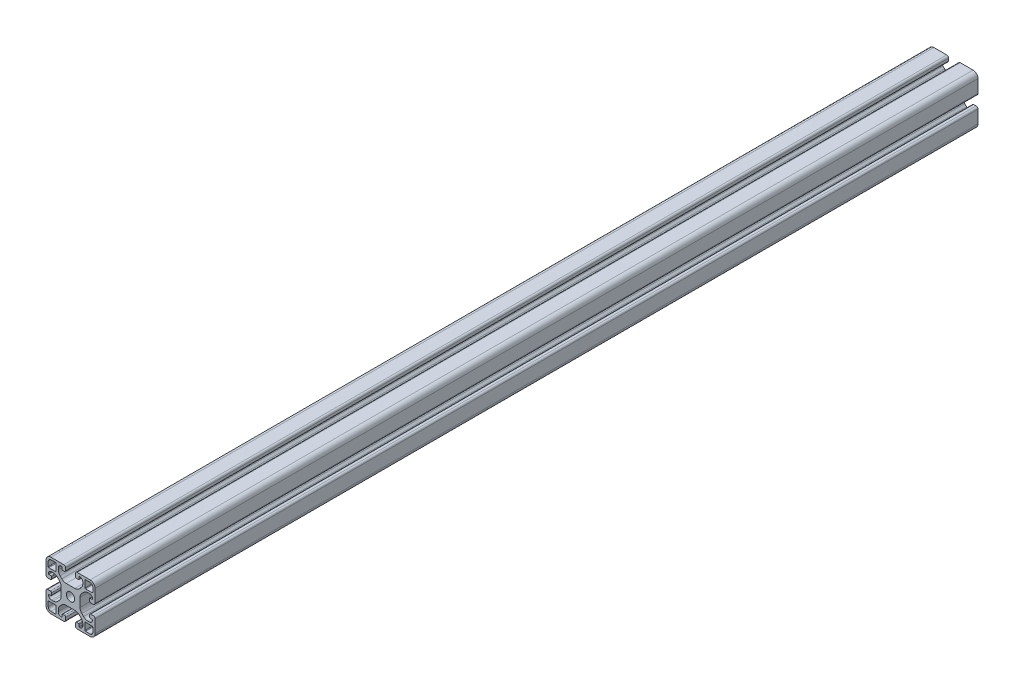
from build123d import *

# Parameters (mm, degrees)
ESQUISSE1_R        = 3.4
BOSS_EXTRU_1_DEPTH = 720


with BuildPart() as part:
    # Esquisse1 → Boss.-Extru.1 (new body)
    with BuildSketch(Plane(origin=(0, 0, -30), x_dir=(-1, 0, 0), z_dir=(0, 0, -1))):
        with BuildLine():
            Line((-4.5, 15), (-4.5, 13.5))
            ThreePointArc((-4.5, 13.5), (-4.353553391, 13.146446609), (-4, 13))
            Line((-4, 13), (-2.5, 13))
            ThreePointArc((-2.5, 13), (-2.146446609, 12.853553391), (-2, 12.5))
            ThreePointArc((-2, 12.5), (-2.732233047, 10.732233047), (-4.5, 10))
            Line((-4.5, 10), (-5.807611845, 10))
            ThreePointArc((-5.807611845, 10), (-7.721029006, 10.380602337), (-9.343145751, 11.464466094))
            Line((-9.343145751, 11.464466094), (-10.785533906, 12.906854249))
            ThreePointArc((-10.785533906, 12.906854249), (-11.869397663, 14.528970994), (-12.25, 16.442388155))
            Line((-12.25, 16.442388155), (-12.25, 23.557611845))
            ThreePointArc((-12.25, 23.557611845), (-11.869397663, 25.471029006), (-10.785533906, 27.093145751))
            Line((-10.785533906, 27.093145751), (-9.343145751, 28.535533906))
            ThreePointArc((-9.343145751, 28.535533906), (-7.721029006, 29.619397663), (-5.807611845, 30))
            Line((-5.807611845, 30), (-4.5, 30))
            ThreePointArc((-4.5, 30), (-2.732233047, 29.267766953), (-2, 27.5))
            ThreePointArc((-2, 27.5), (-2.146446609, 27.146446609), (-2.5, 27))
            Line((-2.5, 27), (-4, 27))
            ThreePointArc((-4, 27), (-4.353553391, 26.853553391), (-4.5, 26.5))
            Line((-4.5, 26.5), (-4.5, 25))
            ThreePointArc((-4.5, 25), (-4.207106781, 24.292893219), (-3.5, 24))
            Line((-3.5, 24), (-1.5, 24))
            ThreePointArc((-1.5, 24), (-0.439339828, 24.439339828), (0, 25.5))
            Line((0, 25.5), (0, 36))
            ThreePointArc((0, 36), (-1.171572875, 38.828427125), (-4, 40))
            Line((-4, 40), (-14.5, 40))
            ThreePointArc((-14.5, 40), (-15.560660172, 39.560660172), (-16, 38.5))
            Line((-16, 38.5), (-16, 36.5))
            ThreePointArc((-16, 36.5), (-15.707106781, 35.792893219), (-15, 35.5))
            Line((-15, 35.5), (-13.5, 35.5))
            ThreePointArc((-13.5, 35.5), (-13.146446609, 35.646446609), (-13, 36))
            Line((-13, 36), (-13, 37.5))
            ThreePointArc((-13, 37.5), (-12.853553391, 37.853553391), (-12.5, 38))
            ThreePointArc((-12.5, 38), (-10.732233047, 37.267766953), (-10, 35.5))
            Line((-10, 35.5), (-10, 34.192388155))
            ThreePointArc((-10, 34.192388155), (-10.380602337, 32.278970994), (-11.464466094, 30.656854249))
            Line((-11.464466094, 30.656854249), (-12.906854249, 29.214466094))
            ThreePointArc((-12.906854249, 29.214466094), (-14.528970994, 28.130602337), (-16.442388155, 27.75))
            Line((-16.442388155, 27.75), (-23.557611845, 27.75))
            ThreePointArc((-23.557611845, 27.75), (-25.471029006, 28.130602337), (-27.093145751, 29.214466094))
            Line((-27.093145751, 29.214466094), (-28.535533906, 30.656854249))
            ThreePointArc((-28.535533906, 30.656854249), (-29.619397663, 32.278970994), (-30, 34.192388155))
            Line((-30, 34.192388155), (-30, 35.5))
            ThreePointArc((-30, 35.5), (-29.267766953, 37.267766953), (-27.5, 38))
            ThreePointArc((-27.5, 38), (-27.146446609, 37.853553391), (-27, 37.5))
            Line((-27, 37.5), (-27, 36))
            ThreePointArc((-27, 36), (-26.853553391, 35.646446609), (-26.5, 35.5))
            Line((-26.5, 35.5), (-25, 35.5))
            ThreePointArc((-25, 35.5), (-24.292893219, 35.792893219), (-24, 36.5))
            Line((-24, 36.5), (-24, 38.5))
            ThreePointArc((-24, 38.5), (-24.439339828, 39.560660172), (-25.5, 40))
            Line((-25.5, 40), (-36, 40))
            ThreePointArc((-36, 40), (-38.828427125, 38.828427125), (-40, 36))
            Line((-40, 36), (-40, 25.5))
            ThreePointArc((-40, 25.5), (-39.560660172, 24.439339828), (-38.5, 24))
            Line((-38.5, 24), (-36.5, 24))
            ThreePointArc((-36.5, 24), (-35.792893219, 24.292893219), (-35.5, 25))
            Line((-35.5, 25), (-35.5, 26.5))
            ThreePointArc((-35.5, 26.5), (-35.646446609, 26.853553391), (-36, 27))
            Line((-36, 27), (-37.5, 27))
            ThreePointArc((-37.5, 27), (-37.853553391, 27.146446609), (-38, 27.5))
            ThreePointArc((-38, 27.5), (-37.267766953, 29.267766953), (-35.5, 30))
            Line((-35.5, 30), (-34.192388155, 30))
            ThreePointArc((-34.192388155, 30), (-32.278970994, 29.619397663), (-30.656854249, 28.535533906))
            Line((-30.656854249, 28.535533906), (-29.214466094, 27.093145751))
            ThreePointArc((-29.214466094, 27.093145751), (-28.130602337, 25.471029006), (-27.75, 23.557611845))
            Line((-27.75, 23.557611845), (-27.75, 16.442388155))
            ThreePointArc((-27.75, 16.442388155), (-28.130602337, 14.528970994), (-29.214466094, 12.906854249))
            Line((-29.214466094, 12.906854249), (-30.656854249, 11.464466094))
            ThreePointArc((-30.656854249, 11.464466094), (-32.278970994, 10.380602337), (-34.192388155, 10))
            Line((-34.192388155, 10), (-35.5, 10))
            ThreePointArc((-35.5, 10), (-37.267766953, 10.732233047), (-38, 12.5))
            ThreePointArc((-38, 12.5), (-37.853553391, 12.853553391), (-37.5, 13))
            Line((-37.5, 13), (-36, 13))
            ThreePointArc((-36, 13), (-35.646446609, 13.146446609), (-35.5, 13.5))
            Line((-35.5, 13.5), (-35.5, 15))
            ThreePointArc((-35.5, 15), (-35.792893219, 15.707106781), (-36.5, 16))
            Line((-36.5, 16), (-38.5, 16))
            ThreePointArc((-38.5, 16), (-39.560660172, 15.560660172), (-40, 14.5))
            Line((-40, 14.5), (-40, 4))
            ThreePointArc((-40, 4), (-38.828427125, 1.171572875), (-36, 0))
            Line((-36, 0), (-25.5, 0))
            ThreePointArc((-25.5, 0), (-24.439339828, 0.439339828), (-24, 1.5))
            Line((-24, 1.5), (-24, 3.5))
            ThreePointArc((-24, 3.5), (-24.292893219, 4.207106781), (-25, 4.5))
            Line((-25, 4.5), (-26.5, 4.5))
            ThreePointArc((-26.5, 4.5), (-26.853553391, 4.353553391), (-27, 4))
            Line((-27, 4), (-27, 2.5))
            ThreePointArc((-27, 2.5), (-27.146446609, 2.146446609), (-27.5, 2))
            ThreePointArc((-27.5, 2), (-29.267766953, 2.732233047), (-30, 4.5))
            Line((-30, 4.5), (-30, 5.807611845))
            ThreePointArc((-30, 5.807611845), (-29.619397663, 7.721029006), (-28.535533906, 9.343145751))
            Line((-28.535533906, 9.343145751), (-27.093145751, 10.785533906))
            ThreePointArc((-27.093145751, 10.785533906), (-25.471029006, 11.869397663), (-23.557611845, 12.25))
            Line((-23.557611845, 12.25), (-16.442388155, 12.25))
            ThreePointArc((-16.442388155, 12.25), (-14.528970994, 11.869397663), (-12.906854249, 10.785533906))
            Line((-12.906854249, 10.785533906), (-11.464466094, 9.343145751))
            ThreePointArc((-11.464466094, 9.343145751), (-10.380602337, 7.721029006), (-10, 5.807611845))
            Line((-10, 5.807611845), (-10, 4.5))
            ThreePointArc((-10, 4.5), (-10.732233047, 2.732233047), (-12.5, 2))
            ThreePointArc((-12.5, 2), (-12.853553391, 2.146446609), (-13, 2.5))
            Line((-13, 2.5), (-13, 4))
            ThreePointArc((-13, 4), (-13.146446609, 4.353553391), (-13.5, 4.5))
            Line((-13.5, 4.5), (-15, 4.5))
            ThreePointArc((-15, 4.5), (-15.707106781, 4.207106781), (-16, 3.5))
            Line((-16, 3.5), (-16, 1.5))
            ThreePointArc((-16, 1.5), (-15.560660172, 0.439339828), (-14.5, 0))
            Line((-14.5, 0), (-4, 0))
            ThreePointArc((-4, 0), (-1.171572875, 1.171572875), (0, 4))
            Line((0, 4), (0, 14.5))
            ThreePointArc((0, 14.5), (-0.439339828, 15.560660172), (-1.5, 16))
            Line((-1.5, 16), (-3.5, 16))
            ThreePointArc((-3.5, 16), (-4.207106781, 15.707106781), (-4.5, 15))
        make_face()
        with Locations((-20, 20)):
            Circle(ESQUISSE1_R, mode=Mode.SUBTRACT)
        with BuildLine():
            Line((-4, 1.8), (-7.7, 1.8))
            ThreePointArc((-7.7, 1.8), (-8.053553391, 1.946446609), (-8.2, 2.3))
            Line((-8.2, 2.3), (-8.2, 7.7))
            ThreePointArc((-8.2, 7.7), (-8.053553391, 8.053553391), (-7.7, 8.2))
            Line((-7.7, 8.2), (-2.3, 8.2))
            ThreePointArc((-2.3, 8.2), (-1.946446609, 8.053553391), (-1.8, 7.7))
            Line((-1.8, 7.7), (-1.8, 4))
            ThreePointArc((-1.8, 4), (-2.444365081, 2.444365081), (-4, 1.8))
        make_face(mode=Mode.SUBTRACT)
        with BuildLine():
            Line((-38.2, 4), (-38.2, 7.7))
            ThreePointArc((-38.2, 7.7), (-38.053553391, 8.053553391), (-37.7, 8.2))
            Line((-37.7, 8.2), (-32.3, 8.2))
            ThreePointArc((-32.3, 8.2), (-31.946446609, 8.053553391), (-31.8, 7.7))
            Line((-31.8, 7.7), (-31.8, 2.3))
            ThreePointArc((-31.8, 2.3), (-31.946446609, 1.946446609), (-32.3, 1.8))
            Line((-32.3, 1.8), (-36, 1.8))
            ThreePointArc((-36, 1.8), (-37.555634919, 2.444365081), (-38.2, 4))
        make_face(mode=Mode.SUBTRACT)
        with BuildLine():
            Line((-36, 38.2), (-32.3, 38.2))
            ThreePointArc((-32.3, 38.2), (-31.946446609, 38.053553391), (-31.8, 37.7))
            Line((-31.8, 37.7), (-31.8, 32.3))
            ThreePointArc((-31.8, 32.3), (-31.946446609, 31.946446609), (-32.3, 31.8))
            Line((-32.3, 31.8), (-37.7, 31.8))
            ThreePointArc((-37.7, 31.8), (-38.053553391, 31.946446609), (-38.2, 32.3))
            Line((-38.2, 32.3), (-38.2, 36))
            ThreePointArc((-38.2, 36), (-37.555634919, 37.555634919), (-36, 38.2))
        make_face(mode=Mode.SUBTRACT)
        with BuildLine():
            Line((-1.8, 36), (-1.8, 32.3))
            ThreePointArc((-1.8, 32.3), (-1.946446609, 31.946446609), (-2.3, 31.8))
            Line((-2.3, 31.8), (-7.7, 31.8))
            ThreePointArc((-7.7, 31.8), (-8.053553391, 31.946446609), (-8.2, 32.3))
            Line((-8.2, 32.3), (-8.2, 37.7))
            ThreePointArc((-8.2, 37.7), (-8.053553391, 38.053553391), (-7.7, 38.2))
            Line((-7.7, 38.2), (-4, 38.2))
            ThreePointArc((-4, 38.2), (-2.444365081, 37.555634919), (-1.8, 36))
        make_face(mode=Mode.SUBTRACT)
    extrude(amount=-BOSS_EXTRU_1_DEPTH)


solid = part.part
